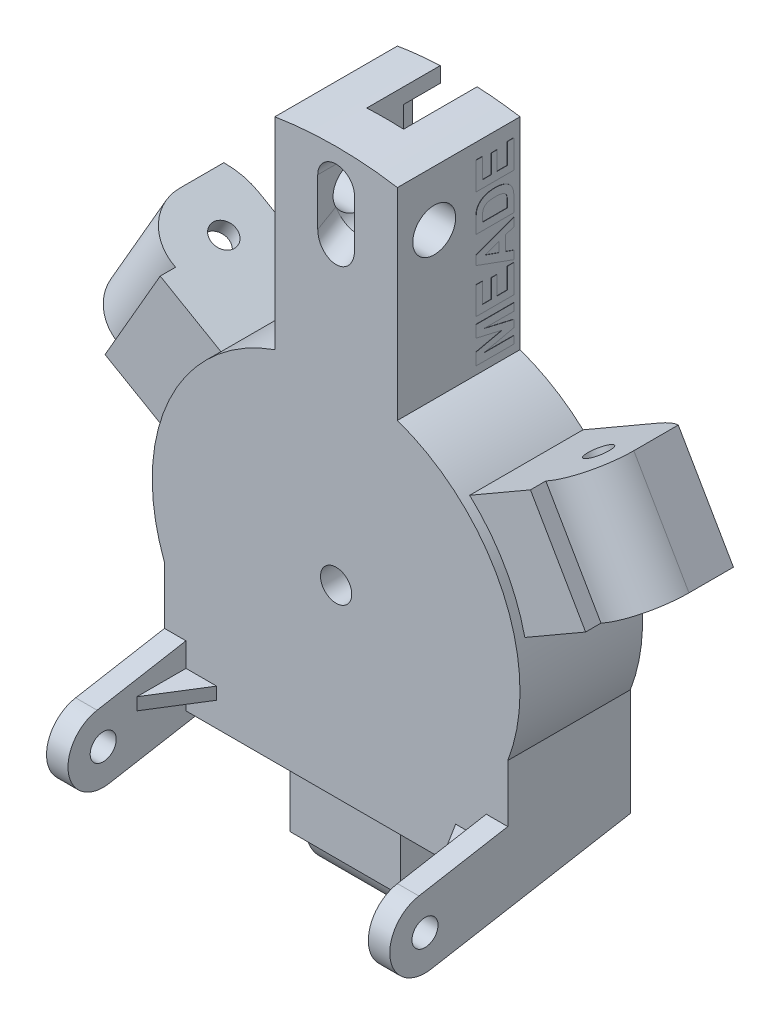
from build123d import *

# Parameters (mm, degrees)
BOSS_EXTRU_1_DEPTH           = 40
ENL_V_START                  = -35
ESQUISSE2_R                  = 55
ENL_V_MAT_EXTRU_1_DEPTH      = 35
BOSS_EXTRU_2_DEPTH           = 14
TROU_TARAUD_M121_D           = 10.2
BOSS_EXTRU_3_START           = -23
BOSS_EXTRU_3_DEPTH           = 23
ENL_V_MAT_EXTRU_2_DEPTH      = 143.13022198
ESQUISSE8_W                  = 12
ESQUISSE8_H                  = 24
ENL_V_MAT_EXTRU_3_DEPTH      = 177.411450876
ESQUISSE9_R                  = 7
ENL_V_MAT_EXTRU_4_DEPTH      = 153.892118829
ESQUISSE10_R                 = 4
BOSS_EXTRU_6_DEPTH           = 18
BOSS_EXTRU_7_REACH           = 198.695
BOSS_EXTRU_7_END_RADIUS      = 60
ESQUISSE11_W                 = 7.091287885
ESQUISSE11_H                 = 35
ENL_V_START_2                = -27
ENL_V_MAT_EXTRU_5_DEPTH      = 27
ENL_V_MAT_EXTRU_6_DEPTH      = 26
R_P_TITION_CIRCULAIRE2_COUNT = 3
BOSS_EXTRU_10_REACH          = 196.592
BOSS_EXTRU_11_REACH          = 196.592
ESQUISSE19_R                 = 4.25
BOSS_EXTRU_12_DEPTH          = 7
ENL_V_MAT_EXTRU_7_DEPTH      = 7
NERVURE1_REACH               = 202.912
ESQUISSE21_WALL_W            = 422.691266206
ESQUISSE21_WALL_H            = 4
BOSS_EXTRU_13_DEPTH          = 0.1
R_P_TITION_CIRCULAIRE3_COUNT = 2
ENL_V_MAT_EXTRU_8_DEPTH      = 174.070886288
ENL_V_MAT_EXTRU_8_DEPTH_BACK = 11


with BuildPart() as part:
    # Esquisse1 → Boss.-Extru.1 (new body)
    with BuildSketch(Plane.XY):
        with BuildLine():
            Line((-20, 122.376468326), (-20, 56.568542495))
            ThreePointArc((-20, 56.568542495), (-54.490933636, 25.114500822), (-56, -21.540659229))
            Line((-56, -21.540659229), (-56, -60))
            Line((-56, -60), (56, -60))
            Line((56, -60), (56, -21.540659229))
            ThreePointArc((56, -21.540659229), (54.490933636, 25.114500822), (20, 56.568542495))
            Line((20, 56.568542495), (20, 122.376468326))
            ThreePointArc((20, 122.376468326), (0, 124), (-20, 122.376468326))
        make_face()
    extrude(amount=-BOSS_EXTRU_1_DEPTH)

    # Esquisse2 → Enlèv. mat.-Extru.1 (cut)
    with BuildSketch(Plane(origin=(0, 0, -40), x_dir=(-1, 0, 0), z_dir=(0, 0, -1)).offset(ENL_V_START)):
        with BuildLine():
            Line((-49, -40.435133238), (-49, -60))
            Line((-49, -60), (4e-09, -60))
            ThreePointArc((4e-09, -60), (-25.02152627, -54.533688882), (-45.483870968, -39.130774102))
            ThreePointArc((-45.483870968, -39.130774102), (-47.695608344, -38.559998835), (-49, -40.435133238))
        make_face()
        with BuildLine():
            ThreePointArc((45.483870968, -39.130774102), (25.021526273, -54.533688881), (4e-09, -60))
            Line((4e-09, -60), (49, -60))
            Line((49, -60), (49, -40.435133238))
            ThreePointArc((49, -40.435133238), (47.695608344, -38.559998835), (45.483870968, -39.130774102))
        make_face()
        Circle(ESQUISSE2_R)
        with BuildLine():
            ThreePointArc((-12.580645161, 58.666237031), (-14.257237114, 59.066350723), (-15, 60.621778265))
            Line((-15, 60.621778265), (-15, 116.27553483))
            ThreePointArc((-15, 116.27553483), (-14.490711985, 117.608868163), (-13.222222222, 118.26315081))
            ThreePointArc((-13.222222222, 118.26315081), (0, 119), (13.222222222, 118.26315081))
            ThreePointArc((13.222222222, 118.26315081), (14.490711985, 117.608868163), (15, 116.27553483))
            Line((15, 116.27553483), (15, 60.621778265))
            ThreePointArc((15, 60.621778265), (14.257237114, 59.066350723), (12.580645161, 58.666237031))
            ThreePointArc((12.580645161, 58.666237031), (0, 60), (-12.580645161, 58.666237031))
        make_face()
    extrude(amount=ENL_V_MAT_EXTRU_1_DEPTH, mode=Mode.SUBTRACT)

    # Esquisse3 → Boss.-Extru.2 (add)
    with BuildSketch(Plane(origin=(0, 0, -5), x_dir=(-1, 0, 0), z_dir=(0, 0, -1))):
        with BuildLine():
            Line((2, 12.338962679), (2, 54.963624335))
            ThreePointArc((2, 54.963624335), (0, 55), (-2, 54.963624335))
            Line((-2, 54.963624335), (-2, 12.338962679))
            ThreePointArc((-2, 12.338962679), (-6.25, 10.825317547), (-9.685855137, 7.901532147))
            Line((-9.685855137, 7.901532147), (-46.599894958, 29.213862975))
            ThreePointArc((-46.599894958, 29.213862975), (-47.631397208, 27.5), (-48.599894958, 25.74976136))
            Line((-48.599894958, 25.74976136), (-11.685855137, 4.437430532))
            ThreePointArc((-11.685855137, 4.437430532), (-12.5, 0), (-11.685855137, -4.437430532))
            Line((-11.685855137, -4.437430532), (-48.599894958, -25.74976136))
            ThreePointArc((-48.599894958, -25.74976136), (-47.631397208, -27.5), (-46.599894958, -29.213862975))
            Line((-46.599894958, -29.213862975), (-9.685855137, -7.901532147))
            ThreePointArc((-9.685855137, -7.901532147), (-6.25, -10.825317547), (-2, -12.338962679))
            Line((-2, -12.338962679), (-2, -54.963624335))
            ThreePointArc((-2, -54.963624335), (0, -55), (2, -54.963624335))
            Line((2, -54.963624335), (2, -12.338962679))
            ThreePointArc((2, -12.338962679), (6.25, -10.825317547), (9.685855137, -7.901532147))
            Line((9.685855137, -7.901532147), (46.599894958, -29.213862975))
            ThreePointArc((46.599894958, -29.213862975), (47.631397208, -27.5), (48.599894958, -25.74976136))
            Line((48.599894958, -25.74976136), (11.685855137, -4.437430532))
            ThreePointArc((11.685855137, -4.437430532), (12.5, 0), (11.685855137, 4.437430532))
            Line((11.685855137, 4.437430532), (48.599894958, 25.74976136))
            ThreePointArc((48.599894958, 25.74976136), (47.631397208, 27.5), (46.599894958, 29.213862975))
            Line((46.599894958, 29.213862975), (9.685855137, 7.901532147))
            ThreePointArc((9.685855137, 7.901532147), (6.25, 10.825317547), (2, 12.338962679))
        make_face()
    extrude(amount=BOSS_EXTRU_2_DEPTH)

    # Trou taraudé M121 (through all)
    with Locations(Plane(origin=(0, 0, -19), x_dir=(-1, 0, 0), z_dir=(0, 0, -1))):
        with Locations((0, 0)):
            Hole(TROU_TARAUD_M121_D / 2)

    # Esquisse6 → Boss.-Extru.3 (add)
    with BuildSketch(Plane(origin=(0, 0, -28), x_dir=(-1, 0, 0), z_dir=(0, 0, -1)).offset(BOSS_EXTRU_3_START)):
        with BuildLine():
            Line((15, 116.27553483), (15, 92.376468326))
            Line((15, 92.376468326), (9, 92.376468326))
            ThreePointArc((9, 92.376468326), (0, 89.376468326), (-9, 92.376468326))
            Line((-9, 92.376468326), (-15, 92.376468326))
            Line((-15, 92.376468326), (-15, 116.27553483))
            ThreePointArc((-15, 116.27553483), (-14.490711985, 117.608868163), (-13.222222222, 118.26315081))
            ThreePointArc((-13.222222222, 118.26315081), (0, 119.248769918), (13.222222222, 118.26315081))
            ThreePointArc((13.222222222, 118.26315081), (14.490711985, 117.608868163), (15, 116.27553483))
        make_face()
        with BuildLine():
            Line((6, 101), (6, 113))
            ThreePointArc((6, 113), (0, 119), (-6, 113))
            Line((-6, 113), (-6, 101))
            ThreePointArc((-6, 101), (0, 95), (6, 101))
        make_face(mode=Mode.SUBTRACT)
    extrude(amount=BOSS_EXTRU_3_DEPTH)

    # Esquisse7 → Enlèv. mat.-Extru.2 (cut, through all)
    with BuildSketch(Plane(origin=(0, 0, -5), x_dir=(-1, 0, 0), z_dir=(0, 0, -1))):
        with BuildLine():
            Line((6, 101), (6, 113))
            ThreePointArc((6, 113), (0, 119), (-6, 113))
            Line((-6, 113), (-6, 101))
            ThreePointArc((-6, 101), (0, 95), (6, 101))
        make_face()
    extrude(amount=-ENL_V_MAT_EXTRU_2_DEPTH, mode=Mode.SUBTRACT)

    # Esquisse8 → Enlèv. mat.-Extru.3 (cut, through all)
    with BuildSketch(Plane.XZ.offset(-101)):
        with Locations((0, -28)):
            Rectangle(ESQUISSE8_W, ESQUISSE8_H)
    extrude(amount=-ENL_V_MAT_EXTRU_3_DEPTH, mode=Mode.SUBTRACT)

    # Esquisse9 → Enlèv. mat.-Extru.4 (cut, through all)
    with BuildSketch(Plane.ZY.offset(20)):
        with Locations(Location((-12, 104.376468326, 0), (0, 0, 331.160831736))):
            Circle(ESQUISSE9_R)
    extrude(amount=-ENL_V_MAT_EXTRU_4_DEPTH, mode=Mode.SUBTRACT)

    # Esquisse10 → Boss.-Extru.6 (add, symmetric)
    with BuildSketch(Plane(origin=(0, 0, 0), x_dir=(0, 0, -1), z_dir=(1, 0, 0))):
        with BuildLine():
            Line((3, -59), (3, -80.141293545))
            Line((3, -80.141293545), (8.024599397, -80.141293545))
            ThreePointArc((8.024599397, -80.141293545), (12.094024646, -91.298529098), (23, -96))
            Line((23, -96), (37.5, -96))
            ThreePointArc((37.5, -96), (39.366103677, -90.985106011), (40, -85.671944982))
            Line((40, -85.671944982), (40, -59))
            Line((40, -59), (3, -59))
        make_face()
        with Locations((24.5, -81)):
            Circle(ESQUISSE10_R, mode=Mode.SUBTRACT)
    boss_extru_6 = extrude(amount=BOSS_EXTRU_6_DEPTH, both=True)

    # Boss.-Extru.7: up to this cylinder (the profile starts outside it)
    boss_extru_7_end = Plane(origin=(0, 0, -22.5), z_dir=(0, 0, -1)) * Cylinder(BOSS_EXTRU_7_END_RADIUS, 518.39, mode=Mode.PRIVATE)
    # Esquisse11 → Boss.-Extru.7 (add, up to the surface)
    with BuildSketch(Plane(origin=(0, -59, 0), x_dir=(1, 0, 0), z_dir=(0, 1, 0)), mode=Mode.PRIVATE) as boss_extru_7_sk1:
        with Locations((14.454356058, 22.5)):
            Rectangle(ESQUISSE11_W, ESQUISSE11_H)
    boss_extru_7_tool1 = extrude(boss_extru_7_sk1.sketch, amount=BOSS_EXTRU_7_REACH, mode=Mode.PRIVATE) - boss_extru_7_end
    add(boss_extru_7_tool1.solids().sort_by_distance((14.454356, -59, -22.5))[0])
    # Esquisse11 → Boss.-Extru.7 (add, up to the surface)
    with BuildSketch(Plane(origin=(0, -59, 0), x_dir=(1, 0, 0), z_dir=(0, 1, 0)), mode=Mode.PRIVATE) as boss_extru_7_sk2:
        with Locations((-14.454356058, 22.5)):
            Rectangle(ESQUISSE11_W, ESQUISSE11_H)
    boss_extru_7_tool2 = extrude(boss_extru_7_sk2.sketch, amount=BOSS_EXTRU_7_REACH, mode=Mode.PRIVATE) - boss_extru_7_end
    add(boss_extru_7_tool2.solids().sort_by_distance((-14.454356, -59, -22.5))[0])

    # Esquisse14 → Enlèv. mat.-Extru.5 (cut)
    with BuildSketch(Plane(origin=(0, 0, -40), x_dir=(-1, 0, 0), z_dir=(0, 0, -1)).offset(ENL_V_START_2)):
        with BuildLine():
            Line((-13, -76.129140229), (-13, -58.574738582))
            ThreePointArc((-13, -58.574738582), (0, -60), (13, -58.574738582))
            Line((13, -58.574738582), (13, -76.129140229))
            Line((13, -76.129140229), (-13, -76.129140229))
        make_face()
    enl_v_mat_extru_5 = extrude(amount=ENL_V_MAT_EXTRU_5_DEPTH, mode=Mode.SUBTRACT)

    # Esquisse16 → Enlèv. mat.-Extru.6 (cut)
    with BuildSketch(Plane.ZY.offset(-13)):
        with BuildLine():
            Line((-23, -91), (-39.362493101, -91))
            ThreePointArc((-39.362493101, -91), (-39.840056899, -88.354974302), (-40, -85.671944982))
            Line((-40, -85.671944982), (-40, -76.129140229))
            Line((-40, -76.129140229), (-13, -76.129140229))
            Line((-13, -76.129140229), (-13, -81))
            ThreePointArc((-13, -81), (-15.928932188, -88.071067812), (-23, -91))
        make_face()
    enl_v_mat_extru_6 = extrude(amount=ENL_V_MAT_EXTRU_6_DEPTH, mode=Mode.SUBTRACT)

    # Répétition circulaire2: Boss.-Extru.6, Enlèv. mat.-Extru.5, Enlèv. mat.-Extru.6 ×3 about axis
    r_p_tition_circulaire2_axis = Axis((0, 0, 0), (0, 0, 1))
    add([boss_extru_6.rotate(r_p_tition_circulaire2_axis, i * 360 / R_P_TITION_CIRCULAIRE2_COUNT) for i in range(1, R_P_TITION_CIRCULAIRE2_COUNT)])
    add([enl_v_mat_extru_5.rotate(r_p_tition_circulaire2_axis, i * 360 / R_P_TITION_CIRCULAIRE2_COUNT) for i in range(1, R_P_TITION_CIRCULAIRE2_COUNT)], mode=Mode.SUBTRACT)
    add([enl_v_mat_extru_6.rotate(r_p_tition_circulaire2_axis, i * 360 / R_P_TITION_CIRCULAIRE2_COUNT) for i in range(1, R_P_TITION_CIRCULAIRE2_COUNT)], mode=Mode.SUBTRACT)

    # Esquisse17 → Boss.-Extru.10 (add, up to next)
    with BuildSketch(Plane(origin=(-51.095498823, 29.5, 0), x_dir=(0, 0, -1), z_dir=(0.8660254037844363, -0.5000000000000042, 0)), mode=Mode.PRIVATE) as boss_extru_10_sk1:
        Polygon((40, -18), (40, -13), (13, -13), (13, -10.908712115), (3, -10.908712115), (3, -18), align=None)
    boss_extru_10_tool1 = extrude(boss_extru_10_sk1.sketch, amount=BOSS_EXTRU_10_REACH, mode=Mode.PRIVATE) - part.part
    # Esquisse17 → Boss.-Extru.10 (add, up to next)
    with BuildSketch(Plane(origin=(-51.095498823, 29.5, 0), x_dir=(0, 0, -1), z_dir=(0.8660254037844363, -0.5000000000000042, 0)), mode=Mode.PRIVATE) as boss_extru_10_sk2:
        Polygon((13, 10.908712115), (13, 13), (40, 13), (40, 18), (3, 18), (3, 10.908712115), align=None)
    boss_extru_10_tool2 = extrude(boss_extru_10_sk2.sketch, amount=BOSS_EXTRU_10_REACH, mode=Mode.PRIVATE) - part.part
    add(boss_extru_10_tool1.solids().sort_by_distance((-58.665448, 16.388464, -20.128916))[0])
    add(boss_extru_10_tool2.solids().sort_by_distance((-43.52555, 42.611536, -20.128916))[0])

    # Esquisse18 → Boss.-Extru.11 (add, up to next)
    with BuildSketch(Plane(origin=(51.095498823, 29.5, 0), x_dir=(0, 0, 1), z_dir=(-0.8660254037844435, -0.49999999999999195, 0)), mode=Mode.PRIVATE) as boss_extru_11_sk1:
        Polygon((-13, -10.908712115), (-13, -13), (-40, -13), (-40, -18), (-3, -18), (-3, -10.908712115), align=None)
    boss_extru_11_tool1 = extrude(boss_extru_11_sk1.sketch, amount=BOSS_EXTRU_11_REACH, mode=Mode.PRIVATE) - part.part
    # Esquisse18 → Boss.-Extru.11 (add, up to next)
    with BuildSketch(Plane(origin=(51.095498823, 29.5, 0), x_dir=(0, 0, 1), z_dir=(-0.8660254037844435, -0.49999999999999195, 0)), mode=Mode.PRIVATE) as boss_extru_11_sk2:
        Polygon((-40, 18), (-40, 13), (-13, 13), (-13, 10.908712115), (-3, 10.908712115), (-3, 18), align=None)
    boss_extru_11_tool2 = extrude(boss_extru_11_sk2.sketch, amount=BOSS_EXTRU_11_REACH, mode=Mode.PRIVATE) - part.part
    add(boss_extru_11_tool1.solids().sort_by_distance((58.665448, 16.388464, -20.128916))[0])
    add(boss_extru_11_tool2.solids().sort_by_distance((43.52555, 42.611536, -20.128916))[0])

    # Esquisse19 → Boss.-Extru.12 (add)
    with BuildSketch(Plane(origin=(56, 0, 0), x_dir=(0, 0, -1), z_dir=(1, 0, 0))):
        with BuildLine():
            Line((40, -56.5), (-25.003045957, -67.96179083))
            ThreePointArc((-25.003045957, -67.96179083), (-38.32528916, -58.633455714), (-28.996954043, -45.311212511))
            Line((-28.996954043, -45.311212511), (40, -33.145187927))
            Line((40, -33.145187927), (40, -56.5))
        make_face()
        with Locations((-27, -56.636501671)):
            Circle(ESQUISSE19_R, mode=Mode.SUBTRACT)
    boss_extru_12 = extrude(amount=-BOSS_EXTRU_12_DEPTH)

    # Esquisse20 → Enlèv. mat.-Extru.7 (cut)
    with BuildSketch(Plane(origin=(56, 0, 0), x_dir=(0, 0, -1), z_dir=(1, 0, 0))):
        Polygon((40, -56.5), (20.150513631, -60), (40, -60), align=None)
    enl_v_mat_extru_7 = extrude(amount=-ENL_V_MAT_EXTRU_7_DEPTH, mode=Mode.SUBTRACT)

    # Esquisse21 wall → Nervure1 (add, up to next)
    with BuildSketch(Plane(origin=(44, -50, 8), x_dir=(-0.529998940003, 0, -0.847998304005), z_dir=(0.847998304005, 0, -0.529998940003)), mode=Mode.PRIVATE) as nervure1_sk1:
        Rectangle(ESQUISSE21_WALL_W, ESQUISSE21_WALL_H)
    nervure1_tool1 = extrude(nervure1_sk1.sketch, amount=NERVURE1_REACH, mode=Mode.PRIVATE) - part.part
    nervure1 = nervure1_tool1.solids().sort_by_distance((44, -50, 8))[0]
    add(nervure1)

    # Symétrie1: Boss.-Extru.12, Enlèv. mat.-Extru.7, Nervure1 across plane
    add(boss_extru_12.mirror(Plane(origin=(0, 0, 0), x_dir=(0, 0, 1), z_dir=(1, 0, 0))))
    add(enl_v_mat_extru_7.mirror(Plane(origin=(0, 0, 0), x_dir=(0, 0, 1), z_dir=(1, 0, 0))), mode=Mode.SUBTRACT)
    add(nervure1.mirror(Plane(origin=(0, 0, 0), x_dir=(0, 0, 1), z_dir=(1, 0, 0))))

    # Esquisse22 → Boss.-Extru.13 (add)
    # profile 1 of 5: a face of its own
    with BuildSketch(Plane.ZY.offset(20)):
        Polygon((-37.895146912, 118.758239716), (-25.567217225, 118.758239716), (-25.567217225, 114.855729506), (-34.137730031, 112.914480838), (-25.567217225, 110.928203206), (-25.567217225, 107.07072196), (-37.895146912, 107.07072196), (-37.895146912, 109.472266704), (-28.031302197, 109.472266704), (-37.895146912, 111.763740648), (-37.895146912, 114.117754819), (-28.031302197, 116.356694972), (-37.895146912, 116.356694972), align=None)
    # profile 2 of 5: a face of its own
    with BuildSketch(Plane.ZY.offset(20)):
        Polygon((-37.895146912, 104.829280199), (-25.567217225, 104.829280199), (-25.567217225, 95.863513153), (-27.648556003, 95.863513153), (-27.648556003, 102.427735454), (-30.530409696, 102.427735454), (-30.530409696, 96.343822102), (-32.451645492, 96.343822102), (-32.451645492, 102.427735454), (-35.813808134, 102.427735454), (-35.813808134, 95.70341017), (-37.895146912, 95.70341017), align=None)
    # profile 3 of 5: a face of its own
    with BuildSketch(Plane.ZY.offset(20)):
        Polygon((-37.895146912, 82.895171534), (-37.895146912, 85.584401326), (-35.173396202, 86.540016005), (-35.173396202, 91.250545957), (-37.895146912, 92.206160636), (-37.895146912, 94.902895256), (-25.567217225, 90.407503687), (-25.567217225, 87.400569539), align=None)
        Polygon((-33.092057423, 87.272987474), (-28.4715854, 88.899033395), (-33.092057423, 90.520076097), align=None, mode=Mode.SUBTRACT)
    # profile 4 of 5: a face of its own
    with BuildSketch(Plane.ZY.offset(20)):
        with BuildLine():
            Line((-25.567217225, 81.61434767), (-25.567217225, 77.18149633))
            add(Edge.make_bspline(
                [(-25.567217225, 77.18149633), (-25.568121433, 77.045562373), (-25.569869423, 76.782778746), (-25.584866822, 76.400673173), (-25.610162216, 76.045390798), (-25.641165029, 75.71462665), (-25.68581818, 75.41073734), (-25.741660699, 75.132293638), (-25.801895649, 74.878091029), (-25.903233849, 74.574519357), (-26.059955251, 74.218285277), (-26.301917629, 73.813932842), (-26.595173903, 73.42544226), (-26.94419555, 73.057124033), (-27.34764833, 72.715700191), (-27.808762573, 72.412060569), (-28.326546273, 72.150059559), (-28.79554511, 71.96355657), (-29.20101837, 71.839856258), (-29.525884669, 71.753516894), (-29.870300345, 71.684538239), (-30.232531772, 71.627199534), (-30.613108954, 71.582703901), (-31.011039532, 71.54953479), (-31.427520339, 71.533346267), (-31.711158796, 71.529716606), (-31.856262524, 71.527859744)],
                knots=[0, 0, 0, 0, 1.002962189, 1.938897741, 2.820879521, 3.630839478, 4.389592299, 5.085824425, 5.725998788, 6.315533336, 7.445015085, 8.589892949, 9.78474894, 11.029507551, 12.326205663, 13.676014285, 15.093135375, 16.601282414, 17.393354726, 18.220106319, 19.080448007, 19.983740095, 20.925481955, 21.907022311, 22.929274721, 24, 24, 24, 24], degree=3))
            add(Edge.make_bspline(
                [(-31.856262524, 71.527859744), (-32.114142446, 71.533011627), (-32.613702499, 71.542991757), (-33.337764198, 71.623452188), (-34.010402701, 71.756849411), (-34.628976951, 71.944077873), (-35.188001435, 72.174802787), (-35.690385003, 72.431490201), (-36.130865935, 72.718885734), (-36.512577111, 73.037748844), (-36.839185273, 73.39068854), (-37.119872003, 73.776368576), (-37.362890223, 74.193357714), (-37.524043077, 74.570204436), (-37.633927909, 74.890036186), (-37.703463231, 75.150222904), (-37.763547076, 75.4264261), (-37.809978981, 75.719757855), (-37.847760087, 76.028475793), (-37.874576812, 76.353932488), (-37.893160842, 76.69680232), (-37.894474247, 76.931309096), (-37.895146912, 77.051412656)],
                knots=[0, 0, 0, 0, 1.650773341, 3.197846539, 4.657435279, 6.035602448, 7.32846078, 8.524785477, 9.642777633, 10.688662335, 11.701117676, 12.71344632, 13.737240328, 14.78459569, 15.331620775, 15.901487116, 16.507802109, 17.140639483, 17.802192609, 18.498733302, 19.231120408, 20, 20, 20, 20], degree=3))
            Line((-37.895146912, 77.051412656), (-37.895146912, 81.61434767))
            Line((-37.895146912, 81.61434767), (-25.567217225, 81.61434767))
        make_face()
        with BuildLine():
            Line((-27.648556003, 79.212802926), (-35.813808134, 79.212802926))
            Line((-35.813808134, 79.212802926), (-35.813808134, 77.401637931))
            add(Edge.make_bspline(
                [(-35.813808134, 77.401637931), (-35.813741592, 77.308223227), (-35.813613219, 77.128005622), (-35.801008193, 76.867124725), (-35.792425837, 76.625602036), (-35.766853622, 76.405002895), (-35.744508421, 76.204176382), (-35.710819862, 76.023315554), (-35.674841874, 75.861763253), (-35.618381077, 75.675053054), (-35.529875643, 75.466927145), (-35.401552112, 75.239365383), (-35.251134763, 75.034456739), (-35.070631087, 74.850698924), (-34.84914955, 74.687474131), (-34.577406041, 74.542949744), (-34.252419928, 74.415824645), (-33.874984141, 74.296193511), (-33.436339402, 74.202146399), (-32.934332584, 74.137985848), (-32.369026307, 74.094209088), (-31.970596674, 74.091127175), (-31.761201378, 74.089507472)],
                knots=[0, 0, 0, 0, 0.90476048, 1.745482874, 2.530079119, 3.244642017, 3.895902862, 4.486915695, 5.025778609, 5.498525387, 6.374670005, 7.210293172, 8.024559573, 8.829962729, 9.695919272, 10.679069312, 11.802594095, 13.07236647, 14.511048699, 16.141283512, 17.972045708, 20, 20, 20, 20], degree=3))
            add(Edge.make_bspline(
                [(-31.761201378, 74.089507472), (-31.650281445, 74.089517952), (-31.433366428, 74.089538448), (-31.118125716, 74.103308356), (-30.82044484, 74.121134462), (-30.541393295, 74.141184195), (-30.279854394, 74.175912493), (-30.036566721, 74.211168703), (-29.811275142, 74.257025071), (-29.540445088, 74.325134101), (-29.230528061, 74.42839089), (-28.896596814, 74.590127837), (-28.603226823, 74.779999594), (-28.351650083, 75.00258885), (-28.144063813, 75.255313408), (-27.970737052, 75.530696341), (-27.838565431, 75.833557315), (-27.785546434, 76.048967031), (-27.758626804, 76.158338204)],
                knots=[0, 0, 0, 0, 1.079461018, 2.110993924, 3.070367774, 3.982291974, 4.83292664, 5.637559408, 6.374510009, 7.069366365, 8.355211183, 9.545806529, 10.671331857, 11.746359752, 12.801098777, 13.84377822, 14.905209522, 16, 16, 16, 16], degree=3))
            add(Edge.make_bspline(
                [(-27.758626804, 76.158338204), (-27.74986502, 76.205801857), (-27.730718037, 76.309523395), (-27.709313171, 76.480753974), (-27.688559178, 76.681666249), (-27.675456381, 76.912082764), (-27.661705418, 77.172189177), (-27.655662676, 77.461658687), (-27.650312414, 77.781029075), (-27.649157318, 78.003688671), (-27.648556003, 78.119599746)],
                knots=[0, 0, 0, 0, 0.588836984, 1.286775748, 2.10484144, 3.053090493, 4.102357057, 5.283060106, 6.585628343, 8, 8, 8, 8], degree=3))
            Line((-27.648556003, 78.119599746), (-27.648556003, 79.212802926))
        make_face(mode=Mode.SUBTRACT)
    # profile 5 of 5: a face of its own
    with BuildSketch(Plane.ZY.offset(20)):
        Polygon((-37.895146912, 69.606623949), (-25.567217225, 69.606623949), (-25.567217225, 60.640856903), (-27.648556003, 60.640856903), (-27.648556003, 67.205079204), (-30.530409696, 67.205079204), (-30.530409696, 61.121165852), (-32.451645492, 61.121165852), (-32.451645492, 67.205079204), (-35.813808134, 67.205079204), (-35.813808134, 60.48075392), (-37.895146912, 60.48075392), align=None)
    boss_extru_13 = extrude(amount=BOSS_EXTRU_13_DEPTH)

    # Répétition circulaire3: Boss.-Extru.13 ×2 about axis
    r_p_tition_circulaire3_axis = Axis((0, 89, -43.925), (0, 0, 1))
    for i in range(1, R_P_TITION_CIRCULAIRE3_COUNT):
        add(boss_extru_13.rotate(r_p_tition_circulaire3_axis, i * 360 / R_P_TITION_CIRCULAIRE3_COUNT))

    # Esquisse23 → Enlèv. mat.-Extru.8 (cut, two sides: drawn at the far end of the back side and taken through both)
    with BuildSketch(Plane(origin=(0, 25.25, -43.734282891), x_dir=(1, 0, 0), z_dir=(0, -0.500000000000001, 0.866025403784438)).offset(-ENL_V_MAT_EXTRU_8_DEPTH_BACK)):
        with BuildLine():
            Line((-6, 87.468565782), (-6, 84.468565782))
            ThreePointArc((-6, 84.468565782), (0, 78.468565782), (6, 84.468565782))
            Line((6, 84.468565782), (6, 87.468565782))
            ThreePointArc((6, 87.468565782), (0, 93.468565782), (-6, 87.468565782))
        make_face()
    extrude(amount=ENL_V_MAT_EXTRU_8_DEPTH + ENL_V_MAT_EXTRU_8_DEPTH_BACK, mode=Mode.SUBTRACT)


solid = part.part
